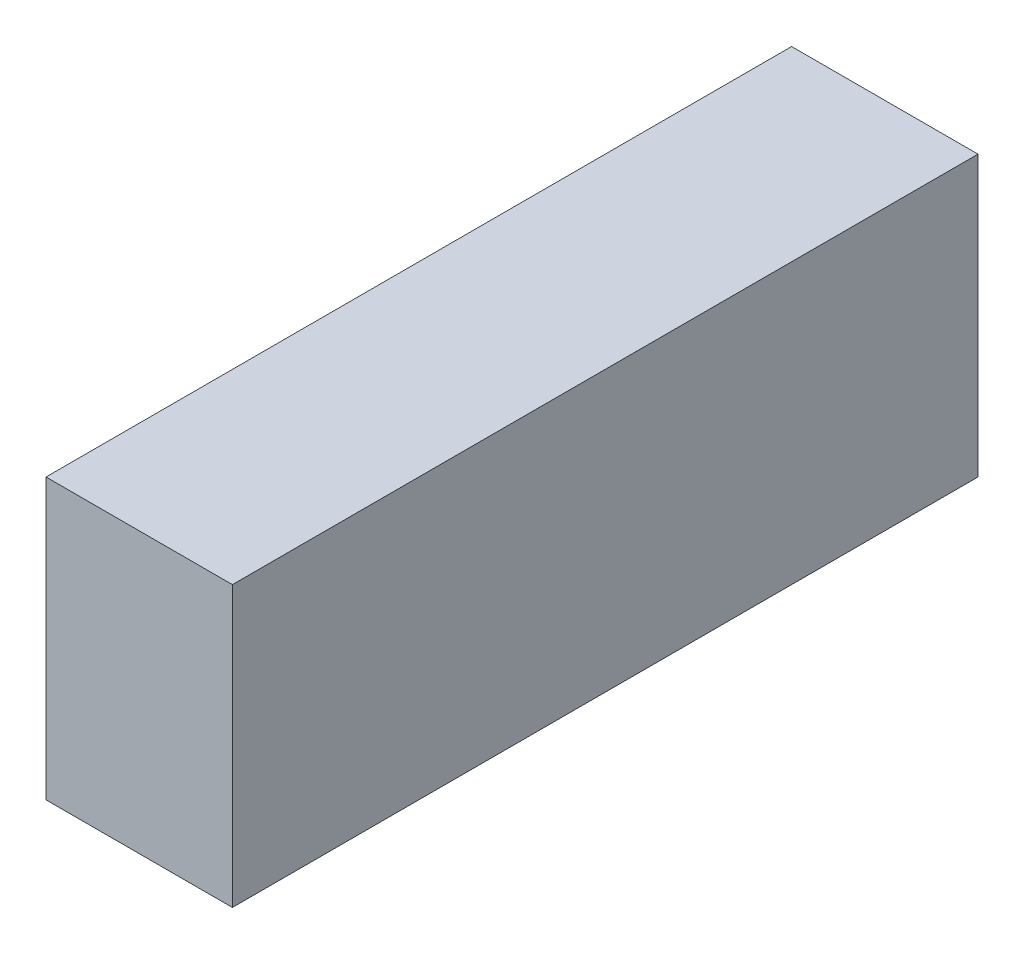
from build123d import *

# Parameters (mm, degrees)
CEK_DONMUS_KAYIS_BAGLANTI_PABUCU_1_START = -40
SKETCH1_W                                = 10
SKETCH1_H                                = 15
CEK_DONMUS_KAYIS_BAGLANTI_PABUCU_1_DEPTH = 40


with BuildPart() as part:
    # Sketch1 → CEK_donmus_kayis_baglanti_pabucu_1 (new body)
    with BuildSketch(Plane.XY.offset(CEK_DONMUS_KAYIS_BAGLANTI_PABUCU_1_START)):
        with Locations((7, 40.5)):
            Rectangle(SKETCH1_W, SKETCH1_H)
    extrude(amount=-CEK_DONMUS_KAYIS_BAGLANTI_PABUCU_1_DEPTH)


solid = part.part
